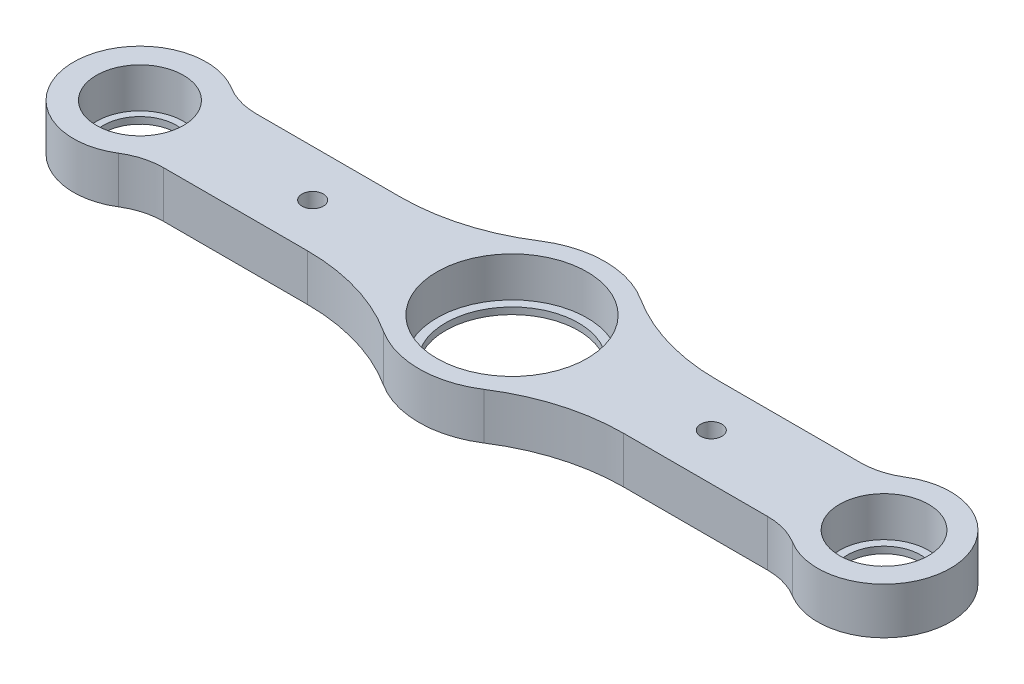
from build123d import *

# Parameters (mm, degrees)
SKETCH_1_R          = 10
SKETCH_1_R_2        = 5.5
SKETCH_1_R_3        = 1.6
EXTRUDE_1_DEPTH     = 7
SKETCH_3_R          = 6.55
SKETCH_3_R_2        = 6.7
CUT_EXTRUDE_1_DEPTH = 6
SKETCH_4_R          = 11.3
CUT_EXTRUDE_2_DEPTH = 6


with BuildPart() as part:
    # Эскиз1 → Бобышка-Вытянуть1 (new body)
    with BuildSketch(Plane(origin=(0, 0, 0), x_dir=(1, 0, 0), z_dir=(0, 1, 0))):
        with BuildLine():
            Line((-23.8117618, 7), (-45.464346247, 7))
            ThreePointArc((-45.464346247, 7), (-48.202959035, 7.382307969), (-50.732173124, 8.5))
            ThreePointArc((-50.732173124, 8.5), (-66, 0), (-50.732173124, -8.5))
            ThreePointArc((-50.732173124, -8.5), (-48.202959035, -7.382307969), (-45.464346247, -7))
            Line((-45.464346247, -7), (-23.8117618, -7))
            ThreePointArc((-23.8117618, -7), (-15.350620677, -8.217903292), (-7.576469664, -11.772727273))
            ThreePointArc((-7.576469664, -11.772727273), (0, -14), (7.576469664, -11.772727273))
            ThreePointArc((7.576469664, -11.772727273), (15.350620677, -8.217903292), (23.8117618, -7))
            Line((23.8117618, -7), (45.464346247, -7))
            ThreePointArc((45.464346247, -7), (48.202959035, -7.382307969), (50.732173124, -8.5))
            ThreePointArc((50.732173124, -8.5), (66, 0), (50.732173124, 8.5))
            ThreePointArc((50.732173124, 8.5), (48.202959035, 7.382307969), (45.464346247, 7))
            Line((45.464346247, 7), (23.8117618, 7))
            ThreePointArc((23.8117618, 7), (15.350620677, 8.217903292), (7.576469664, 11.772727273))
            ThreePointArc((7.576469664, 11.772727273), (0, 14), (-7.576469664, 11.772727273))
            ThreePointArc((-7.576469664, 11.772727273), (-15.350620677, 8.217903292), (-23.8117618, 7))
        make_face()
        with Locations(Location((0, 0, 0), (0, 0, 270))):
            Circle(SKETCH_1_R, mode=Mode.SUBTRACT)
        with Locations(Location((56, 0, 0), (0, 0, 270))):
            Circle(SKETCH_1_R_2, mode=Mode.SUBTRACT)
        with Locations(Location((-56, 0, 0), (0, 0, 90))):
            Circle(SKETCH_1_R_2, mode=Mode.SUBTRACT)
        with Locations(Location((-30, 0, 0), (0, 0, 270))):
            Circle(SKETCH_1_R_3, mode=Mode.SUBTRACT)
        with Locations(Location((30, 0, 0), (0, 0, 270))):
            Circle(SKETCH_1_R_3, mode=Mode.SUBTRACT)
    extrude(amount=EXTRUDE_1_DEPTH)

    # Эскиз3 → Вырез-Вытянуть1 (cut)
    with BuildSketch(Plane(origin=(0, 7, 0), x_dir=(1, 0, 0), z_dir=(0, 1, 0))):
        with Locations(Location((-56, 0, 0), (0, 0, 270))):
            Circle(SKETCH_3_R)
        with Locations(Location((56, 0, 0), (0, 0, 270))):
            Circle(SKETCH_3_R_2)
    extrude(amount=-CUT_EXTRUDE_1_DEPTH, mode=Mode.SUBTRACT)

    # Эскиз4 → Вырез-Вытянуть2 (cut)
    with BuildSketch(Plane(origin=(0, 7, 0), x_dir=(1, 0, 0), z_dir=(0, 1, 0))):
        with Locations(Location((0, 0, 0), (0, 0, 270))):
            Circle(SKETCH_4_R)
    extrude(amount=-CUT_EXTRUDE_2_DEPTH, mode=Mode.SUBTRACT)


solid = part.part
